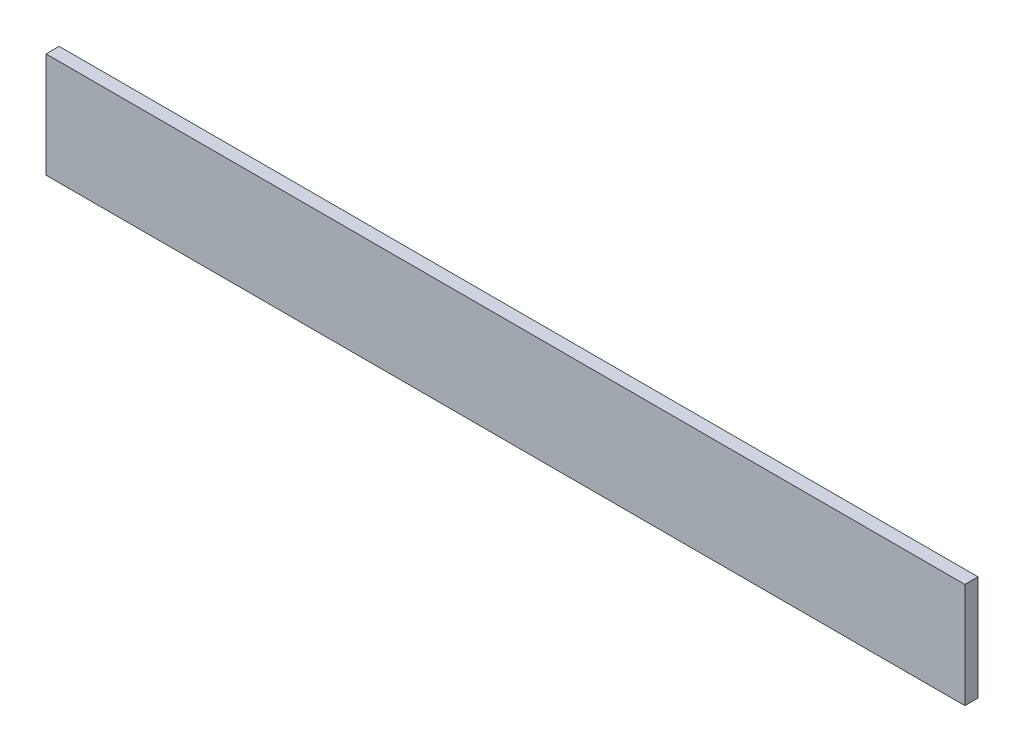
from build123d import *

# Parameters (mm, degrees)
SKETCH_1_W      = 350
SKETCH_1_H      = 40
EXTRUDE_1_DEPTH = 5


with BuildPart() as part:
    # 草图1 → 凸台-拉伸1 (new body)
    with BuildSketch(Plane.XY):
        Rectangle(SKETCH_1_W, SKETCH_1_H)
    extrude(amount=EXTRUDE_1_DEPTH)


solid = part.part
